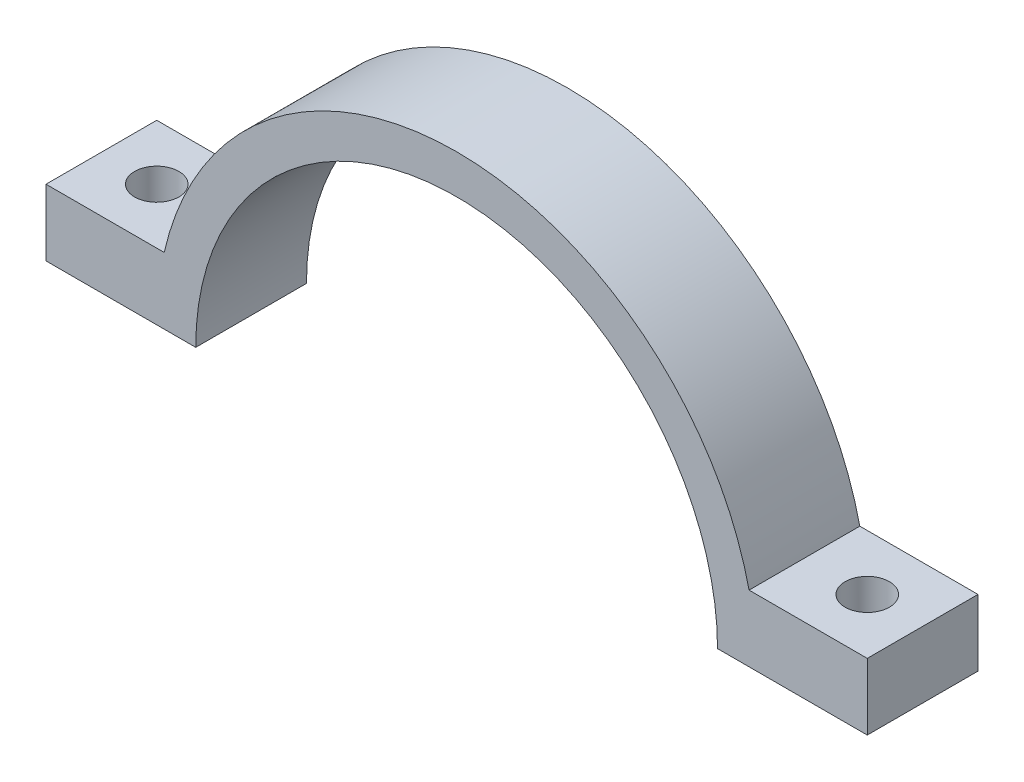
from build123d import *

# Parameters (mm, degrees)
BOSS_EXTRUDE1_DEPTH = 5
SKETCH2_R           = 1
CUT_EXTRUDE1_DEPTH  = 5


with BuildPart() as part:
    # Sketch1 → Boss-Extrude1 (new body)
    with BuildSketch(Plane.XY):
        with BuildLine():
            Line((18.54, 0), (18.54, 3))
            Line((18.54, 3), (13.203469241, 3))
            ThreePointArc((13.203469241, 3), (0, 13.54), (-13.203469241, 3))
            Line((-13.203469241, 3), (-18.54, 3))
            Line((-18.54, 3), (-18.54, 0))
            Line((-18.54, 0), (-13.54, 0))
            Line((-13.54, 0), (-11.78, 0))
            ThreePointArc((-11.78, 0), (0, 11.78), (11.78, 0))
            Line((11.78, 0), (13.54, 0))
            Line((13.54, 0), (18.54, 0))
        make_face()
    extrude(amount=BOSS_EXTRUDE1_DEPTH)

    # Sketch2 → Cut-Extrude1 (cut)
    with BuildSketch(Plane(origin=(0, 3, 0), x_dir=(1, 0, 0), z_dir=(0, 1, 0))):
        with Locations(Location((-16.04, -2.5, 0), (0, 0, 270))):
            Circle(SKETCH2_R)
        with Locations(Location((16.04, -2.5, 0), (0, 0, 270))):
            Circle(SKETCH2_R)
    extrude(amount=-CUT_EXTRUDE1_DEPTH, mode=Mode.SUBTRACT)


solid = part.part
